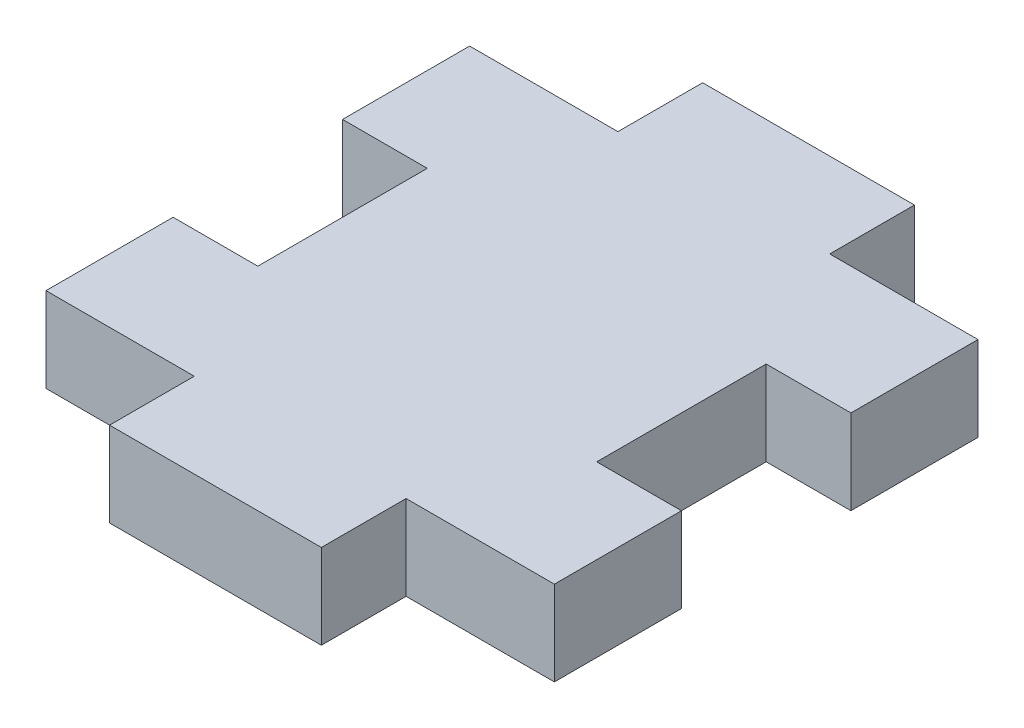
from build123d import *

# Parameters (mm, degrees)
BOSS_EXTRUDE1_DEPTH = 12.7


with BuildPart() as part:
    # Sketch1 → Boss-Extrude1 (new body)
    with BuildSketch(Plane(origin=(0, 0, 0), x_dir=(1, 0, 0), z_dir=(0, 1, 0))):
        Polygon((-15.875, -31.75), (-38.1, -31.75), (-38.1, -12.7), (-25.4, -12.7), (-25.4, 12.7), (-38.1, 12.7), (-38.1, 31.75), (-15.875, 31.75), (-15.875, 44.45), (15.875, 44.45), (15.875, 31.75), (38.1, 31.75), (38.1, 12.7), (25.4, 12.7), (25.4, -12.7), (38.1, -12.7), (38.1, -31.75), (15.875, -31.75), (15.875, -44.45), (-15.875, -44.45), align=None)
    extrude(amount=BOSS_EXTRUDE1_DEPTH)


solid = part.part
